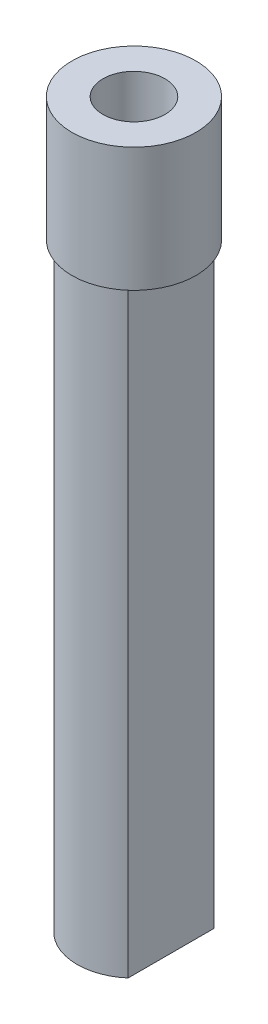
from build123d import *

# Parameters (mm, degrees)
IZIM2_R                     = 3
Y_KSEKLIK_EKSTR_ZYON1_DEPTH = 6
IZIM3_R                     = 1.5
KES_EKSTR_ZYON1_DEPTH       = 3
Y_KSEKLIK_EKSTR_ZYON2_DEPTH = 29


with BuildPart() as part:
    # Çizim2 → Yükseklik-Ekstrüzyon1 (new body)
    with BuildSketch(Plane(origin=(0, 0, 0), x_dir=(1, 0, 0), z_dir=(0, 1, 0))):
        with Locations(Location((0, 0, 0), (0, 0, 270))):
            Circle(IZIM2_R)
    extrude(amount=Y_KSEKLIK_EKSTR_ZYON1_DEPTH)

    # Çizim3 → Kes-Ekstrüzyon1 (cut)
    with BuildSketch(Plane(origin=(0, 6, 0), x_dir=(1, 0, 0), z_dir=(0, 1, 0))):
        with Locations(Location((0, 0, 0), (0, 0, 270))):
            Circle(IZIM3_R)
    extrude(amount=-KES_EKSTR_ZYON1_DEPTH, mode=Mode.SUBTRACT)

    # Çizim4 → Yükseklik-Ekstrüzyon2 (add)
    with BuildSketch(Plane.XZ):
        with BuildLine():
            ThreePointArc((1.79891634, 2.08), (0, 2.75), (-1.79891634, 2.08))
            Line((-1.79891634, 2.08), (-1.79891634, -2.08))
            ThreePointArc((-1.79891634, -2.08), (0, -2.75), (1.79891634, -2.08))
            Line((1.79891634, -2.08), (1.79891634, 2.08))
        make_face()
    extrude(amount=Y_KSEKLIK_EKSTR_ZYON2_DEPTH)


solid = part.part
